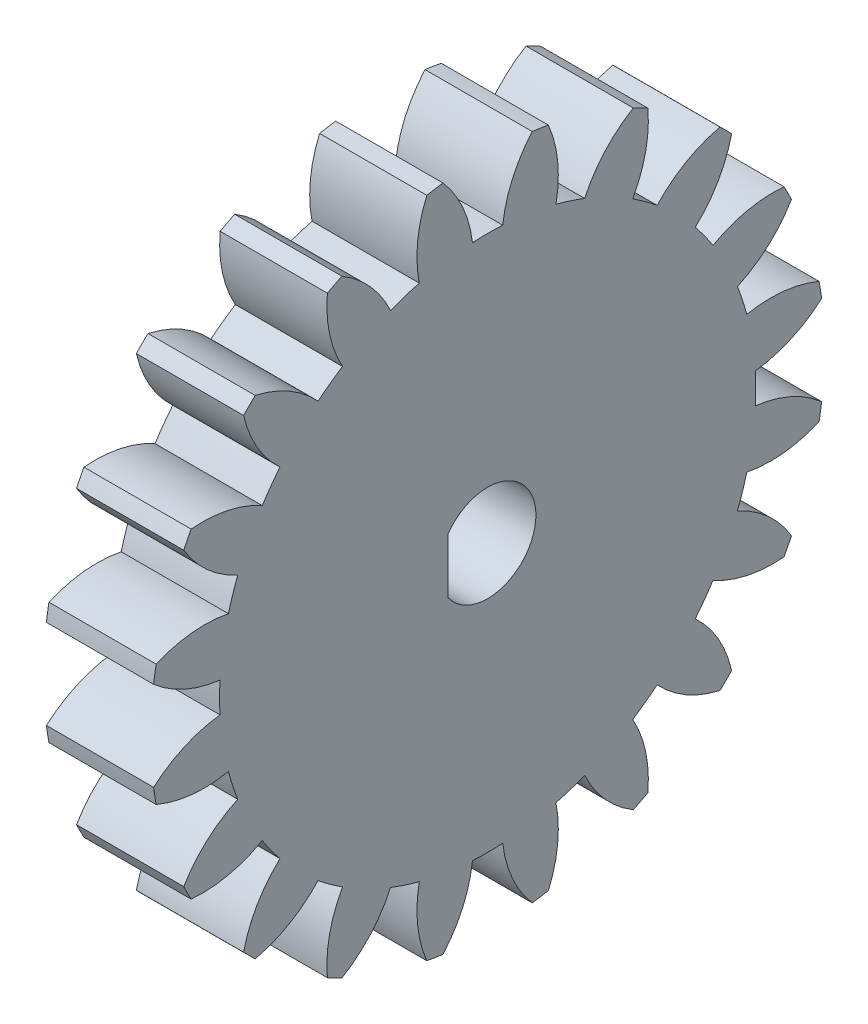
from build123d import *

# Parameters (mm, degrees)
BASPROSKE_W              = 7
BASPROSKE_H              = 22
TOOTHCUT_DEPTH           = 32.890437438
TEETHCUTS_COUNT          = 20
TEETHCUTS_ANGLE          = 342
HUBNEAONESKE_R           = 7
HUBNEARONE_DEPTH         = 6.0000508
BORSKE_R                 = 3
BORE_DEPTH               = 13.0000508
CUT_EXTRUDE_3_DEPTH      = 34.466904857
CUT_EXTRUDE_3_DEPTH_BACK = 34.466904857
SKETCH_4_R               = 3.15
EXTRUDE_1_DEPTH          = 13.000051
CUT_EXTRUDE_4_DEPTH      = 32.623288929
CUT_EXTRUDE_4_DEPTH_BACK = 32.623288929
SKETCH_2_R               = 1.65
CUT_EXTRUDE_5_DEPTH      = 2


with BuildPart() as part:
    # BasProSke → Base-Revolve (revolve)
    with BuildSketch(Plane(origin=(0, 0, 0), x_dir=(1, 0, 0), z_dir=(0, 1, 0)), mode=Mode.PRIVATE) as base_revolve_sk:
        with Locations((3.5, 11)):
            Rectangle(BASPROSKE_W, BASPROSKE_H)
    revolve(base_revolve_sk.sketch.rotate(Axis((-10, 0, 0), (1, 0, 0)), 180), axis=Axis((-10, 0, 0), (1, 0, 0)))

    # TooCutSke → ToothCut (cut, through all)
    with BuildSketch(Plane(origin=(0, 0, 0), x_dir=(0, 0, -1), z_dir=(1, 0, 0))):
        with BuildLine():
            ThreePointArc((0.986171591, 17.471189616), (0, 17.499), (-0.986171591, 17.471189616))
            ThreePointArc((-0.986171591, 17.471189616), (-1.626916196, 19.798789858), (-2.932850173, 21.829260982))
            ThreePointArc((-2.932850173, 21.829260982), (0, 22.0254), (2.932850173, 21.829260982))
            ThreePointArc((2.932850173, 21.829260982), (1.626916196, 19.798789858), (0.986171591, 17.471189616))
        make_face()
    toothcut = extrude(amount=TOOTHCUT_DEPTH, mode=Mode.SUBTRACT)

    # TeethCuts: ToothCut ×20 about axis
    teethcuts_axis = Axis((-10, 0, 0), (1, 0, 0))
    for i in range(1, TEETHCUTS_COUNT):
        add(toothcut.rotate(teethcuts_axis, i * TEETHCUTS_ANGLE / (TEETHCUTS_COUNT - 1)), mode=Mode.SUBTRACT)

    # HubNeaOneSke → HubNearOne (add)
    with BuildSketch(Plane.ZY):
        with Locations(Location((0, 0, 0), (0, 0, 180))):
            Circle(HUBNEAONESKE_R)
    extrude(amount=HUBNEARONE_DEPTH)

    # BorSke → Bore (cut, symmetric)
    with BuildSketch(Plane(origin=(0, 0, 0), x_dir=(0, 0, -1), z_dir=(1, 0, 0))):
        with Locations(Location((0, 0, 0), (0, 0, 180))):
            Circle(BORSKE_R)
    extrude(amount=BORE_DEPTH, both=True, mode=Mode.SUBTRACT)

    # 草图4 → 切除-拉伸3 (cut, two sides: drawn at the far end of the back side and taken through both)
    with BuildSketch(Plane.ZY.offset(6.0000508).offset(-CUT_EXTRUDE_3_DEPTH_BACK)):
        Circle(SKETCH_4_R)
    extrude(amount=CUT_EXTRUDE_3_DEPTH + CUT_EXTRUDE_3_DEPTH_BACK, mode=Mode.SUBTRACT)

    # 草图1 → 凸台-拉伸1 (add, through all)
    with BuildSketch(Plane.ZY.offset(6.0000508)):
        with BuildLine():
            Line((2.6, 1.778341924), (2.6, -1.778341924))
            ThreePointArc((2.6, -1.778341924), (3.15, 0), (2.6, 1.778341924))
        make_face()
    extrude(amount=-EXTRUDE_1_DEPTH)

    # 草图2 → 切除-拉伸4 (cut, two sides: drawn at the far end of the back side and taken through both)
    with BuildSketch(Plane.XY.offset(-CUT_EXTRUDE_4_DEPTH_BACK)):
        with Locations((-3.5000508, 0)):
            Circle(SKETCH_2_R)
    extrude(amount=CUT_EXTRUDE_4_DEPTH + CUT_EXTRUDE_4_DEPTH_BACK, mode=Mode.SUBTRACT)

    # 草图5 → 切除-拉伸5 (cut)
    with BuildSketch(Plane.XY.offset(-7)):
        Polygon((-6.382322544, 1.704653316), (-6.417459749, -1.643793892), (-3.535188005, -3.348447209), (-0.617779056, -1.704653316), (-0.582641851, 1.643793892), (-3.464913595, 3.348447209), align=None)
    extrude(amount=CUT_EXTRUDE_5_DEPTH, mode=Mode.SUBTRACT)


solid = part.part
